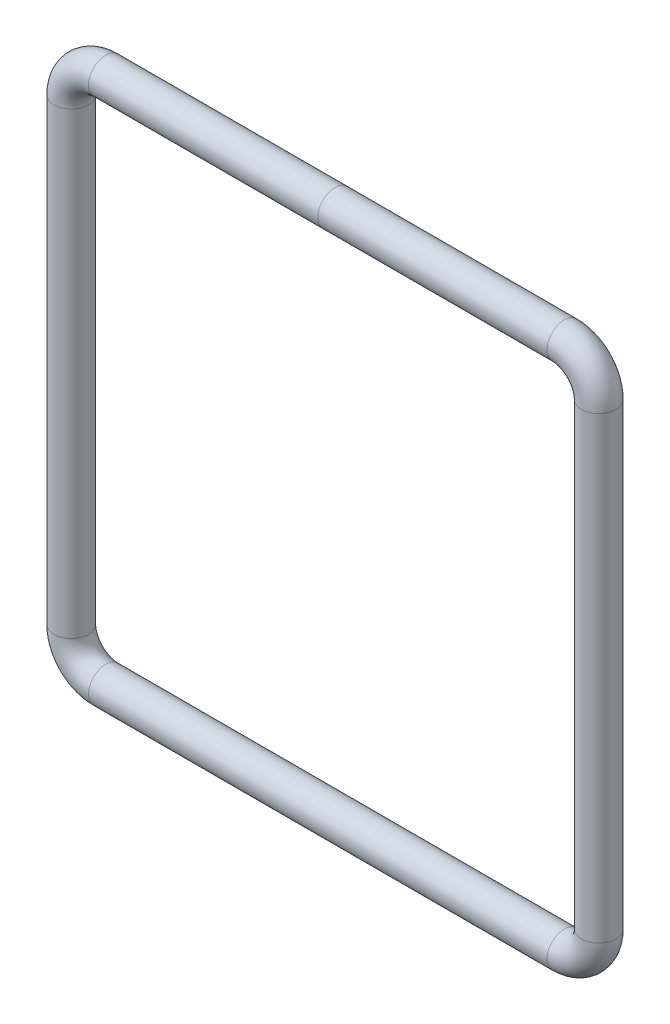
from build123d import *

# Parameters (mm, degrees)
ESBO_O2_R = 2.1


with BuildPart() as part:
    # Varredura1: sweep along a path in Esboço1
    with BuildLine(Plane.XY) as varredura1_path:
        Line((27.9, 32.1), (-27.9, 32.1))
        ThreePointArc((-27.9, 32.1), (-30.869848481, 30.869848481), (-32.1, 27.9))
        Line((-32.1, 27.9), (-32.1, -27.9))
        ThreePointArc((-32.1, -27.9), (-30.869848481, -30.869848481), (-27.9, -32.1))
        Line((-27.9, -32.1), (27.9, -32.1))
        ThreePointArc((27.9, -32.1), (30.869848481, -30.869848481), (32.1, -27.9))
        Line((32.1, -27.9), (32.1, 27.9))
        ThreePointArc((32.1, 27.9), (30.869848481, 30.869848481), (27.9, 32.1))
    # Esboço2 → Varredura1 (sweep)
    with BuildSketch(Plane(origin=(0, 0, 0), x_dir=(0, 0, -1), z_dir=(1, 0, 0))):
        with Locations((0, 32.1)):
            Circle(ESBO_O2_R)
    sweep(path=varredura1_path.line)


solid = part.part
